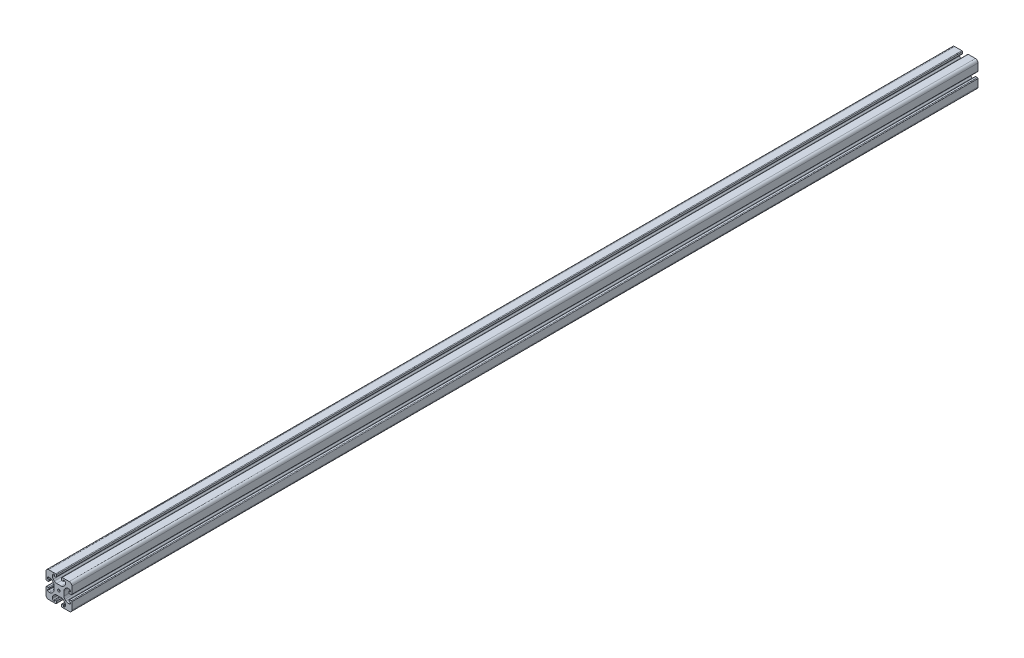
from build123d import *

# Parameters (mm, degrees)
EXTRUDE_3_DEPTH     = 1400
HOLE_WIZARD_M5_1_D  = 4.2
HOLE_WIZARD_M5_2_D  = 4.2
SKETCH_7_R          = 2
CUT_EXTRUDE_1_DEPTH = 2
HOLE_WIZARD_M5_3_D  = 4.2
HOLE_WIZARD_M5_4_D  = 4.2


with BuildPart() as part:
    # Model → 凸台-拉伸3 (new body)
    with BuildSketch(Plane.XY):
        with BuildLine():
            Line((3038.626047963, 1538.554851823), (3045.741173633, 1538.554851823))
            add(Edge.make_bspline(
                [(3049.276921118, 1537.0902465), (3048.8107636, 1537.556481082), (3047.704647958, 1538.266080891), (3046.441138301, 1538.554851823), (3045.741173633, 1538.554851823)],
                knots=[0, 0, 0, 0, 0.489373028, 1, 1, 1, 1], degree=3))
            Line((3049.276921118, 1537.0902465), (3050.719115205, 1535.647813992))
            add(Edge.make_bspline(
                [(3052.183720448, 1532.112305099), (3052.183720448, 1532.801572394), (3051.892347197, 1534.083862245), (3051.192575602, 1535.174275324), (3050.719115205, 1535.647813992)],
                knots=[0, 0, 0, 0, 0.510203542, 1, 1, 1, 1], degree=3))
            Line((3052.183720448, 1532.112305099), (3052.183720448, 1530.804817427))
            add(Edge.make_bspline(
                [(3049.683663262, 1528.304760288), (3050.380891253, 1528.304760288), (3051.623803853, 1528.908542343), (3052.183720448, 1530.04566751), (3052.183720448, 1530.804817427)],
                knots=[0, 0, 0, 0, 0.502793736, 1, 1, 1, 1], degree=3))
            Line((3049.683663262, 1528.304760288), (3049.633595356, 1528.304760288))
            add(Edge.make_bspline(
                [(3049.183699488, 1528.754894547), (3049.183699488, 1528.621135634), (3049.310613574, 1528.399867559), (3049.514098722, 1528.304760288), (3049.633595356, 1528.304760288)],
                knots=[0, 0, 0, 0, 0.549542039, 1, 1, 1, 1], degree=3))
            Line((3049.183699488, 1528.754894547), (3049.183699488, 1530.304853729))
            add(Edge.make_bspline(
                [(3048.683735721, 1530.80481748), (3048.814583007, 1530.80481748), (3049.063948712, 1530.68728955), (3049.183699488, 1530.463207638), (3049.183699488, 1530.304853729)],
                knots=[0, 0, 0, 0, 0.482405948, 1, 1, 1, 1], degree=3))
            Line((3048.683735721, 1530.80481748), (3047.183606011, 1530.80481748))
            add(Edge.make_bspline(
                [(3046.183678534, 1529.804889962), (3046.183678534, 1530.108777492), (3046.477620245, 1530.598884032), (3046.929836169, 1530.80481748), (3047.183606011, 1530.80481748)],
                knots=[0, 0, 0, 0, 0.565195279, 1, 1, 1, 1], degree=3))
            Line((3046.183678534, 1529.804889962), (3046.183678534, 1527.304832729))
            add(Edge.make_bspline(
                [(3047.183606089, 1526.304666828), (3046.967197552, 1526.304664508), (3046.468490599, 1526.522616874), (3046.183678534, 1526.949099653), (3046.183678534, 1527.304832729)],
                knots=[0, 0, 0, 0, 0.421049349, 1, 1, 1, 1], degree=3))
            Line((3047.183606089, 1526.304666828), (3058.183762491, 1526.304784773))
            add(Edge.make_bspline(
                [(3058.183762491, 1526.304784773), (3059.53269494, 1526.304799236), (3061.276507698, 1527.365293091), (3062.183710881, 1529.362340035), (3062.183710881, 1530.304971497)],
                knots=[0, 0, 0, 0, 0.550544017, 1, 1, 1, 1], degree=3))
            Line((3062.183710881, 1530.304971497), (3062.183710881, 1541.304889481))
            add(Edge.make_bspline(
                [(3062.183710881, 1541.304889481), (3062.183710881, 1541.642072865), (3061.918643232, 1542.0781123), (3061.419310763, 1542.304817095), (3061.183545011, 1542.304817095)],
                knots=[0, 0, 0, 0, 0.550414522, 1, 1, 1, 1], degree=3))
            Line((3061.183545011, 1542.304817095), (3058.683726198, 1542.304817095))
            add(Edge.make_bspline(
                [(3058.683726198, 1542.304817095), (3058.347819216, 1542.304817095), (3057.911122877, 1542.041298811), (3057.683560264, 1541.542079896), (3057.683560264, 1541.30488962)],
                knots=[0, 0, 0, 0, 0.548463708, 1, 1, 1, 1], degree=3))
            Line((3057.683560264, 1541.30488962), (3057.683560264, 1539.804759902))
            add(Edge.make_bspline(
                [(3057.683560264, 1539.804759902), (3057.683560264, 1539.638611723), (3057.813635543, 1539.41945383), (3058.063313821, 1539.304796137), (3058.18376242, 1539.304796137)],
                knots=[0, 0, 0, 0, 0.543007867, 1, 1, 1, 1], degree=3))
            Line((3058.18376242, 1539.304796137), (3059.733721607, 1539.304796137))
            add(Edge.make_bspline(
                [(3059.733721607, 1539.304796137), (3059.900592531, 1539.304796137), (3060.08944904, 1539.170214152), (3060.183617459, 1538.946084099), (3060.183617459, 1538.854900293)],
                knots=[0, 0, 0, 0, 0.601271686, 1, 1, 1, 1], degree=3))
            Line((3060.183617459, 1538.854900293), (3060.183617459, 1538.804832319))
            add(Edge.make_bspline(
                [(3060.183617459, 1538.804832319), (3060.183617459, 1537.972969288), (3059.533728376, 1536.87693448), (3058.285558814, 1536.304775171), (3057.683560223, 1536.304775171)],
                knots=[0, 0, 0, 0, 0.54350612, 1, 1, 1, 1], degree=3))
            Line((3057.683560223, 1536.304775171), (3056.376072735, 1536.304775171))
            add(Edge.make_bspline(
                [(3056.376072735, 1536.304775171), (3055.697422379, 1536.304775171), (3054.429528001, 1536.577546077), (3053.324285242, 1537.285658909), (3052.840563739, 1537.769380411)],
                knots=[0, 0, 0, 0, 0.495306505, 1, 1, 1, 1], degree=3))
            Line((3052.840563739, 1537.769380411), (3051.398131257, 1539.211812893))
            add(Edge.make_bspline(
                [(3051.398131257, 1539.211812893), (3050.933823015, 1539.676121135), (3050.239839391, 1540.76814585), (3049.933764339, 1542.050783071), (3049.933764339, 1542.747322003)],
                knots=[0, 0, 0, 0, 0.481772339, 1, 1, 1, 1], degree=3))
            Line((3049.933764339, 1542.747322003), (3049.933764339, 1549.862447649))
            add(Edge.make_bspline(
                [(3051.398131257, 1553.39795676), (3050.933823015, 1552.933648518), (3050.239839391, 1551.841623803), (3049.933764339, 1550.558986582), (3049.933764339, 1549.862447649)],
                knots=[0, 0, 0, 0, 0.481772339, 1, 1, 1, 1], degree=3))
            Line((3051.398131257, 1553.39795676), (3052.840563739, 1554.840389241))
            add(Edge.make_bspline(
                [(3056.376072735, 1556.304994482), (3055.697422379, 1556.304994482), (3054.429528001, 1556.032223576), (3053.324285242, 1555.324110744), (3052.840563739, 1554.840389241)],
                knots=[0, 0, 0, 0, 0.495306505, 1, 1, 1, 1], degree=3))
            Line((3056.376072735, 1556.304994482), (3057.683560223, 1556.304994482))
            add(Edge.make_bspline(
                [(3060.183617459, 1553.804937334), (3060.183617459, 1554.636800364), (3059.533728376, 1555.732835172), (3058.285558814, 1556.304994482), (3057.683560223, 1556.304994482)],
                knots=[0, 0, 0, 0, 0.54350612, 1, 1, 1, 1], degree=3))
            Line((3060.183617459, 1553.804937334), (3060.183617459, 1553.75486936))
            add(Edge.make_bspline(
                [(3059.733721607, 1553.304973516), (3059.900592531, 1553.304973516), (3060.08944904, 1553.4395555), (3060.183617459, 1553.663685553), (3060.183617459, 1553.75486936)],
                knots=[0, 0, 0, 0, 0.601271686, 1, 1, 1, 1], degree=3))
            Line((3059.733721607, 1553.304973516), (3058.18376242, 1553.304973516))
            add(Edge.make_bspline(
                [(3057.683560264, 1552.80500975), (3057.683560264, 1552.97115793), (3057.813635543, 1553.190315823), (3058.063313821, 1553.304973516), (3058.18376242, 1553.304973516)],
                knots=[0, 0, 0, 0, 0.543007867, 1, 1, 1, 1], degree=3))
            Line((3057.683560264, 1552.80500975), (3057.683560264, 1551.304880033))
            add(Edge.make_bspline(
                [(3058.683726198, 1550.304952558), (3058.347819216, 1550.304952558), (3057.911122877, 1550.568470841), (3057.683560264, 1551.067689757), (3057.683560264, 1551.304880033)],
                knots=[0, 0, 0, 0, 0.548463708, 1, 1, 1, 1], degree=3))
            Line((3058.683726198, 1550.304952558), (3061.183545011, 1550.304952558))
            add(Edge.make_bspline(
                [(3062.183710881, 1551.304880172), (3062.183710881, 1550.967696788), (3061.918643232, 1550.531657353), (3061.419310763, 1550.304952558), (3061.183545011, 1550.304952558)],
                knots=[0, 0, 0, 0, 0.550414522, 1, 1, 1, 1], degree=3))
            Line((3062.183710881, 1551.304880172), (3062.183710881, 1562.304798156))
            add(Edge.make_bspline(
                [(3058.183762491, 1566.30498488), (3059.53269494, 1566.304970416), (3061.276507698, 1565.244476562), (3062.183710881, 1563.247429618), (3062.183710881, 1562.304798156)],
                knots=[0, 0, 0, 0, 0.550544017, 1, 1, 1, 1], degree=3))
            Line((3058.183762491, 1566.30498488), (3047.183606089, 1566.305102825))
            add(Edge.make_bspline(
                [(3047.183606089, 1566.305102825), (3046.967197552, 1566.305105145), (3046.468490599, 1566.087152778), (3046.183678534, 1565.66067), (3046.183678534, 1565.304936924)],
                knots=[0, 0, 0, 0, 0.421049349, 1, 1, 1, 1], degree=3))
            Line((3046.183678534, 1565.304936924), (3046.183678534, 1562.804879691))
            add(Edge.make_bspline(
                [(3046.183678534, 1562.804879691), (3046.183678534, 1562.500992161), (3046.477620245, 1562.010885621), (3046.929836169, 1561.804952173), (3047.183606011, 1561.804952173)],
                knots=[0, 0, 0, 0, 0.565195279, 1, 1, 1, 1], degree=3))
            Line((3047.183606011, 1561.804952173), (3048.683735721, 1561.804952173))
            add(Edge.make_bspline(
                [(3048.683735721, 1561.804952173), (3048.814583007, 1561.804952173), (3049.063948712, 1561.922480103), (3049.183699488, 1562.146562015), (3049.183699488, 1562.304915923)],
                knots=[0, 0, 0, 0, 0.482405948, 1, 1, 1, 1], degree=3))
            Line((3049.183699488, 1562.304915923), (3049.183699488, 1563.854875106))
            add(Edge.make_bspline(
                [(3049.183699488, 1563.854875106), (3049.183699488, 1563.988634019), (3049.310613574, 1564.209902094), (3049.514098722, 1564.305009365), (3049.633595356, 1564.305009365)],
                knots=[0, 0, 0, 0, 0.549542039, 1, 1, 1, 1], degree=3))
            Line((3049.633595356, 1564.305009365), (3049.683663262, 1564.305009365))
            add(Edge.make_bspline(
                [(3049.683663262, 1564.305009365), (3050.380891253, 1564.305009365), (3051.623803853, 1563.70122731), (3052.183720448, 1562.564102142), (3052.183720448, 1561.804952226)],
                knots=[0, 0, 0, 0, 0.502793736, 1, 1, 1, 1], degree=3))
            Line((3052.183720448, 1561.804952226), (3052.183720448, 1560.497464554))
            add(Edge.make_bspline(
                [(3052.183720448, 1560.497464554), (3052.183720448, 1559.808197259), (3051.892347197, 1558.525907408), (3051.192575602, 1557.435494329), (3050.719115205, 1556.961955661)],
                knots=[0, 0, 0, 0, 0.510203542, 1, 1, 1, 1], degree=3))
            Line((3050.719115205, 1556.961955661), (3049.276921118, 1555.519523152))
            add(Edge.make_bspline(
                [(3049.276921118, 1555.519523152), (3048.8107636, 1555.05328857), (3047.704647958, 1554.343688762), (3046.441138301, 1554.05491783), (3045.741173633, 1554.05491783)],
                knots=[0, 0, 0, 0, 0.489373028, 1, 1, 1, 1], degree=3))
            Line((3045.741173633, 1554.05491783), (3038.626047963, 1554.05491783))
            add(Edge.make_bspline(
                [(3035.090300479, 1555.519523152), (3035.556457996, 1555.05328857), (3036.662573638, 1554.343688762), (3037.926083295, 1554.05491783), (3038.626047963, 1554.05491783)],
                knots=[0, 0, 0, 0, 0.489373028, 1, 1, 1, 1], degree=3))
            Line((3035.090300479, 1555.519523152), (3033.648106391, 1556.961955661))
            add(Edge.make_bspline(
                [(3032.183501148, 1560.497464554), (3032.183501148, 1559.808197259), (3032.474874399, 1558.525907408), (3033.174645994, 1557.435494329), (3033.648106391, 1556.961955661)],
                knots=[0, 0, 0, 0, 0.510203542, 1, 1, 1, 1], degree=3))
            Line((3032.183501148, 1560.497464554), (3032.183501148, 1561.804952226))
            add(Edge.make_bspline(
                [(3034.683558334, 1564.305009365), (3033.986330343, 1564.305009365), (3032.743417743, 1563.70122731), (3032.183501148, 1562.564102142), (3032.183501148, 1561.804952226)],
                knots=[0, 0, 0, 0, 0.502793736, 1, 1, 1, 1], degree=3))
            Line((3034.683558334, 1564.305009365), (3034.73362624, 1564.305009365))
            add(Edge.make_bspline(
                [(3035.183522108, 1563.854875106), (3035.183522108, 1563.988634019), (3035.056608022, 1564.209902094), (3034.853122874, 1564.305009365), (3034.73362624, 1564.305009365)],
                knots=[0, 0, 0, 0, 0.549542039, 1, 1, 1, 1], degree=3))
            Line((3035.183522108, 1563.854875106), (3035.183522108, 1562.304915923))
            add(Edge.make_bspline(
                [(3035.683485875, 1561.804952173), (3035.552638589, 1561.804952173), (3035.303272884, 1561.922480103), (3035.183522108, 1562.146562015), (3035.183522108, 1562.304915923)],
                knots=[0, 0, 0, 0, 0.482405948, 1, 1, 1, 1], degree=3))
            Line((3035.683485875, 1561.804952173), (3037.183615585, 1561.804952173))
            add(Edge.make_bspline(
                [(3038.183543062, 1562.804879691), (3038.183543062, 1562.500992161), (3037.889601351, 1562.010885621), (3037.437385427, 1561.804952173), (3037.183615585, 1561.804952173)],
                knots=[0, 0, 0, 0, 0.565195279, 1, 1, 1, 1], degree=3))
            Line((3038.183543062, 1562.804879691), (3038.183543062, 1565.304936924))
            add(Edge.make_bspline(
                [(3037.183615507, 1566.305102825), (3037.400024044, 1566.305105145), (3037.898730997, 1566.087152778), (3038.183543062, 1565.66067), (3038.183543062, 1565.304936924)],
                knots=[0, 0, 0, 0, 0.421049349, 1, 1, 1, 1], degree=3))
            Line((3037.183615507, 1566.305102825), (3026.183459105, 1566.30498488))
            add(Edge.make_bspline(
                [(3026.183459105, 1566.30498488), (3024.834526656, 1566.304970416), (3023.090713898, 1565.244476562), (3022.183510715, 1563.247429618), (3022.183510715, 1562.304798156)],
                knots=[0, 0, 0, 0, 0.550544017, 1, 1, 1, 1], degree=3))
            Line((3022.183510715, 1562.304798156), (3022.183510715, 1551.304880172))
            add(Edge.make_bspline(
                [(3022.183510715, 1551.304880172), (3022.183510715, 1550.967696788), (3022.448578364, 1550.531657353), (3022.947910833, 1550.304952558), (3023.183676585, 1550.304952558)],
                knots=[0, 0, 0, 0, 0.550414522, 1, 1, 1, 1], degree=3))
            Line((3023.183676585, 1550.304952558), (3025.683495398, 1550.304952558))
            add(Edge.make_bspline(
                [(3025.683495398, 1550.304952558), (3026.01940238, 1550.304952558), (3026.45609872, 1550.568470841), (3026.683661332, 1551.067689757), (3026.683661332, 1551.304880033)],
                knots=[0, 0, 0, 0, 0.548463708, 1, 1, 1, 1], degree=3))
            Line((3026.683661332, 1551.304880033), (3026.683661332, 1552.80500975))
            add(Edge.make_bspline(
                [(3026.683661332, 1552.80500975), (3026.683661332, 1552.97115793), (3026.553586053, 1553.190315823), (3026.303907775, 1553.304973516), (3026.183459176, 1553.304973516)],
                knots=[0, 0, 0, 0, 0.543007867, 1, 1, 1, 1], degree=3))
            Line((3026.183459176, 1553.304973516), (3024.633499989, 1553.304973516))
            add(Edge.make_bspline(
                [(3024.633499989, 1553.304973516), (3024.466629065, 1553.304973516), (3024.277772556, 1553.4395555), (3024.183604137, 1553.663685553), (3024.183604137, 1553.75486936)],
                knots=[0, 0, 0, 0, 0.601271686, 1, 1, 1, 1], degree=3))
            Line((3024.183604137, 1553.75486936), (3024.183604137, 1553.804937334))
            add(Edge.make_bspline(
                [(3024.183604137, 1553.804937334), (3024.183604137, 1554.636800364), (3024.833493221, 1555.732835172), (3026.081662782, 1556.304994482), (3026.683661373, 1556.304994482)],
                knots=[0, 0, 0, 0, 0.54350612, 1, 1, 1, 1], degree=3))
            Line((3026.683661373, 1556.304994482), (3027.991148861, 1556.304994482))
            add(Edge.make_bspline(
                [(3027.991148861, 1556.304994482), (3028.669799217, 1556.304994482), (3029.937693595, 1556.032223576), (3031.042936355, 1555.324110744), (3031.526657857, 1554.840389241)],
                knots=[0, 0, 0, 0, 0.495306505, 1, 1, 1, 1], degree=3))
            Line((3031.526657857, 1554.840389241), (3032.969090339, 1553.39795676))
            add(Edge.make_bspline(
                [(3032.969090339, 1553.39795676), (3033.433398581, 1552.933648518), (3034.127382205, 1551.841623803), (3034.433457257, 1550.558986582), (3034.433457257, 1549.862447649)],
                knots=[0, 0, 0, 0, 0.481772339, 1, 1, 1, 1], degree=3))
            Line((3034.433457257, 1549.862447649), (3034.433457257, 1542.747322003))
            add(Edge.make_bspline(
                [(3032.969090339, 1539.211812893), (3033.433398581, 1539.676121135), (3034.127382205, 1540.76814585), (3034.433457257, 1542.050783071), (3034.433457257, 1542.747322003)],
                knots=[0, 0, 0, 0, 0.481772339, 1, 1, 1, 1], degree=3))
            Line((3032.969090339, 1539.211812893), (3031.526657857, 1537.769380411))
            add(Edge.make_bspline(
                [(3027.991148861, 1536.304775171), (3028.669799217, 1536.304775171), (3029.937693595, 1536.577546077), (3031.042936355, 1537.285658909), (3031.526657857, 1537.769380411)],
                knots=[0, 0, 0, 0, 0.495306505, 1, 1, 1, 1], degree=3))
            Line((3027.991148861, 1536.304775171), (3026.683661373, 1536.304775171))
            add(Edge.make_bspline(
                [(3024.183604137, 1538.804832319), (3024.183604137, 1537.972969288), (3024.833493221, 1536.87693448), (3026.081662782, 1536.304775171), (3026.683661373, 1536.304775171)],
                knots=[0, 0, 0, 0, 0.54350612, 1, 1, 1, 1], degree=3))
            Line((3024.183604137, 1538.804832319), (3024.183604137, 1538.854900293))
            add(Edge.make_bspline(
                [(3024.633499989, 1539.304796137), (3024.466629065, 1539.304796137), (3024.277772556, 1539.170214152), (3024.183604137, 1538.946084099), (3024.183604137, 1538.854900293)],
                knots=[0, 0, 0, 0, 0.601271686, 1, 1, 1, 1], degree=3))
            Line((3024.633499989, 1539.304796137), (3026.183459176, 1539.304796137))
            add(Edge.make_bspline(
                [(3026.683661332, 1539.804759902), (3026.683661332, 1539.638611723), (3026.553586053, 1539.41945383), (3026.303907775, 1539.304796137), (3026.183459176, 1539.304796137)],
                knots=[0, 0, 0, 0, 0.543007867, 1, 1, 1, 1], degree=3))
            Line((3026.683661332, 1539.804759902), (3026.683661332, 1541.30488962))
            add(Edge.make_bspline(
                [(3025.683495398, 1542.304817095), (3026.01940238, 1542.304817095), (3026.45609872, 1542.041298811), (3026.683661332, 1541.542079896), (3026.683661332, 1541.30488962)],
                knots=[0, 0, 0, 0, 0.548463708, 1, 1, 1, 1], degree=3))
            Line((3025.683495398, 1542.304817095), (3023.183676585, 1542.304817095))
            add(Edge.make_bspline(
                [(3022.183510715, 1541.304889481), (3022.183510715, 1541.642072865), (3022.448578364, 1542.0781123), (3022.947910833, 1542.304817095), (3023.183676585, 1542.304817095)],
                knots=[0, 0, 0, 0, 0.550414522, 1, 1, 1, 1], degree=3))
            Line((3022.183510715, 1541.304889481), (3022.183510715, 1530.304971497))
            add(Edge.make_bspline(
                [(3026.183459105, 1526.304784773), (3024.834526656, 1526.304799236), (3023.090713898, 1527.365293091), (3022.183510715, 1529.362340035), (3022.183510715, 1530.304971497)],
                knots=[0, 0, 0, 0, 0.550544017, 1, 1, 1, 1], degree=3))
            Line((3026.183459105, 1526.304784773), (3037.183615507, 1526.304666828))
            add(Edge.make_bspline(
                [(3037.183615507, 1526.304666828), (3037.400024044, 1526.304664508), (3037.898730997, 1526.522616874), (3038.183543062, 1526.949099653), (3038.183543062, 1527.304832729)],
                knots=[0, 0, 0, 0, 0.421049349, 1, 1, 1, 1], degree=3))
            Line((3038.183543062, 1527.304832729), (3038.183543062, 1529.804889962))
            add(Edge.make_bspline(
                [(3038.183543062, 1529.804889962), (3038.183543062, 1530.108777492), (3037.889601351, 1530.598884032), (3037.437385427, 1530.80481748), (3037.183615585, 1530.80481748)],
                knots=[0, 0, 0, 0, 0.565195279, 1, 1, 1, 1], degree=3))
            Line((3037.183615585, 1530.80481748), (3035.683485875, 1530.80481748))
            add(Edge.make_bspline(
                [(3035.683485875, 1530.80481748), (3035.552638589, 1530.80481748), (3035.303272884, 1530.68728955), (3035.183522108, 1530.463207638), (3035.183522108, 1530.304853729)],
                knots=[0, 0, 0, 0, 0.482405948, 1, 1, 1, 1], degree=3))
            Line((3035.183522108, 1530.304853729), (3035.183522108, 1528.754894547))
            add(Edge.make_bspline(
                [(3035.183522108, 1528.754894547), (3035.183522108, 1528.621135634), (3035.056608022, 1528.399867559), (3034.853122874, 1528.304760288), (3034.73362624, 1528.304760288)],
                knots=[0, 0, 0, 0, 0.549542039, 1, 1, 1, 1], degree=3))
            Line((3034.73362624, 1528.304760288), (3034.683558334, 1528.304760288))
            add(Edge.make_bspline(
                [(3034.683558334, 1528.304760288), (3033.986330343, 1528.304760288), (3032.743417743, 1528.908542343), (3032.183501148, 1530.04566751), (3032.183501148, 1530.804817427)],
                knots=[0, 0, 0, 0, 0.502793736, 1, 1, 1, 1], degree=3))
            Line((3032.183501148, 1530.804817427), (3032.183501148, 1532.112305099))
            add(Edge.make_bspline(
                [(3032.183501148, 1532.112305099), (3032.183501148, 1532.801572394), (3032.474874399, 1534.083862245), (3033.174645994, 1535.174275324), (3033.648106391, 1535.647813992)],
                knots=[0, 0, 0, 0, 0.510203542, 1, 1, 1, 1], degree=3))
            Line((3033.648106391, 1535.647813992), (3035.090300479, 1537.0902465))
            add(Edge.make_bspline(
                [(3035.090300479, 1537.0902465), (3035.556457996, 1537.556481082), (3036.662573638, 1538.266080891), (3037.926083295, 1538.554851823), (3038.626047963, 1538.554851823)],
                knots=[0, 0, 0, 0, 0.489373028, 1, 1, 1, 1], degree=3))
        make_face()
    extrude(amount=EXTRUDE_3_DEPTH)

    # M5 螺纹孔1 (through all)
    with Locations(Plane.ZY.offset(-3034.433457257)):
        with Locations((1360, 1546.304884826), (20, 1546.304884826)):
            Hole(HOLE_WIZARD_M5_1_D / 2)

    # M5 螺纹孔2 (through all)
    with Locations(Plane(origin=(0, 1554.05491783, 0), x_dir=(1, 0, 0), z_dir=(0, 1, 0))):
        with Locations((3042.183610798, -20), (3042.183610798, -1360)):
            Hole(HOLE_WIZARD_M5_2_D / 2)

    # 草图7 → 切除-拉伸1 (cut)
    with BuildSketch(Plane.XY.offset(1400)):
        with Locations((3042.183610798, 1546.304884826)):
            Circle(SKETCH_7_R)
    extrude(amount=-CUT_EXTRUDE_1_DEPTH, mode=Mode.SUBTRACT)

    # M5 螺纹孔3 (through all)
    with Locations(Plane(origin=(3049.933764339, 0, 0), x_dir=(0, 0, -1), z_dir=(1, 0, 0))):
        with Locations((-1045, 1546.304884826), (-587.5, 1546.304884826), (-222.5, 1546.304884826)):
            Hole(HOLE_WIZARD_M5_3_D / 2)

    # M5 螺纹孔4 (through all)
    with Locations(Plane(origin=(0, 1554.05491783, 0), x_dir=(1, 0, 0), z_dir=(0, 1, 0))):
        with Locations((3042.183610798, -222.5), (3042.183610798, -587.5), (3042.183610798, -1045)):
            Hole(HOLE_WIZARD_M5_4_D / 2)


solid = part.part
